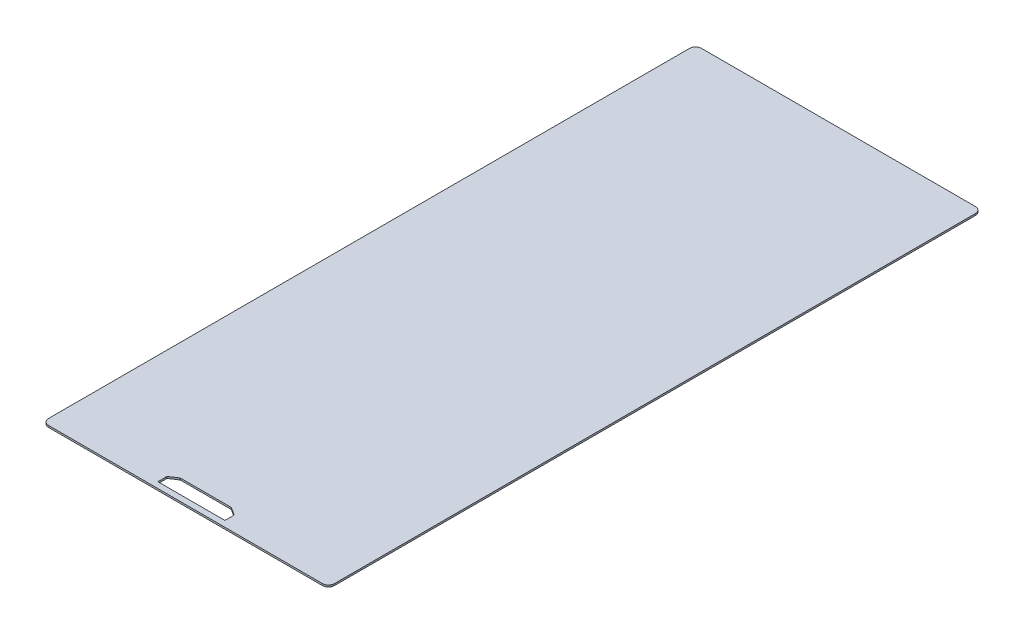
from build123d import *

# Parameters (mm, degrees)
BOSS_EXTRUDE1_DEPTH = 3
CUT_EXTRUDE1_DEPTH  = 603.06602628


with BuildPart() as part:
    # Sketch1 → Boss-Extrude1 (new body)
    with BuildSketch(Plane(origin=(0, 0, 0), x_dir=(1, 0, 0), z_dir=(0, 1, 0))):
        with BuildLine():
            Line((-231.5, -551.5), (231.5, -551.5))
            ThreePointArc((231.5, -551.5), (238.571067812, -548.571067812), (241.5, -541.5))
            Line((241.5, -541.5), (241.5, 541.5))
            ThreePointArc((241.5, 541.5), (238.571067812, 548.571067812), (231.5, 551.5))
            Line((231.5, 551.5), (-231.5, 551.5))
            ThreePointArc((-231.5, 551.5), (-238.571067812, 548.571067812), (-241.5, 541.5))
            Line((-241.5, 541.5), (-241.5, -541.5))
            ThreePointArc((-241.5, -541.5), (-238.571067812, -548.571067812), (-231.5, -551.5))
        make_face()
    extrude(amount=BOSS_EXTRUDE1_DEPTH)

    # Sketch2 → Cut-Extrude1 (cut, through all)
    with BuildSketch(Plane(origin=(0, 3, 0), x_dir=(1, 0, 0), z_dir=(0, 1, 0))):
        with BuildLine():
            Line((-56.625, -541.5), (56.625, -541.5))
            Line((56.625, -541.5), (56.625, -527.339918356))
            ThreePointArc((56.625, -527.339918356), (56.328467778, -526.158931587), (55.5092162, -525.258105322))
            Line((55.5092162, -525.258105322), (43.930335234, -517.559203283))
            ThreePointArc((43.930335234, -517.559203283), (43.269122289, -517.247845556), (42.546119034, -517.141016318))
            Line((42.546119034, -517.141016318), (-42.546119034, -517.141016318))
            ThreePointArc((-42.546119034, -517.141016318), (-43.269122289, -517.247845556), (-43.930335234, -517.559203283))
            Line((-43.930335234, -517.559203283), (-55.5092162, -525.258105322))
            ThreePointArc((-55.5092162, -525.258105322), (-56.328467778, -526.158931587), (-56.625, -527.339918356))
            Line((-56.625, -527.339918356), (-56.625, -541.5))
        make_face()
    extrude(amount=-CUT_EXTRUDE1_DEPTH, mode=Mode.SUBTRACT)


solid = part.part
